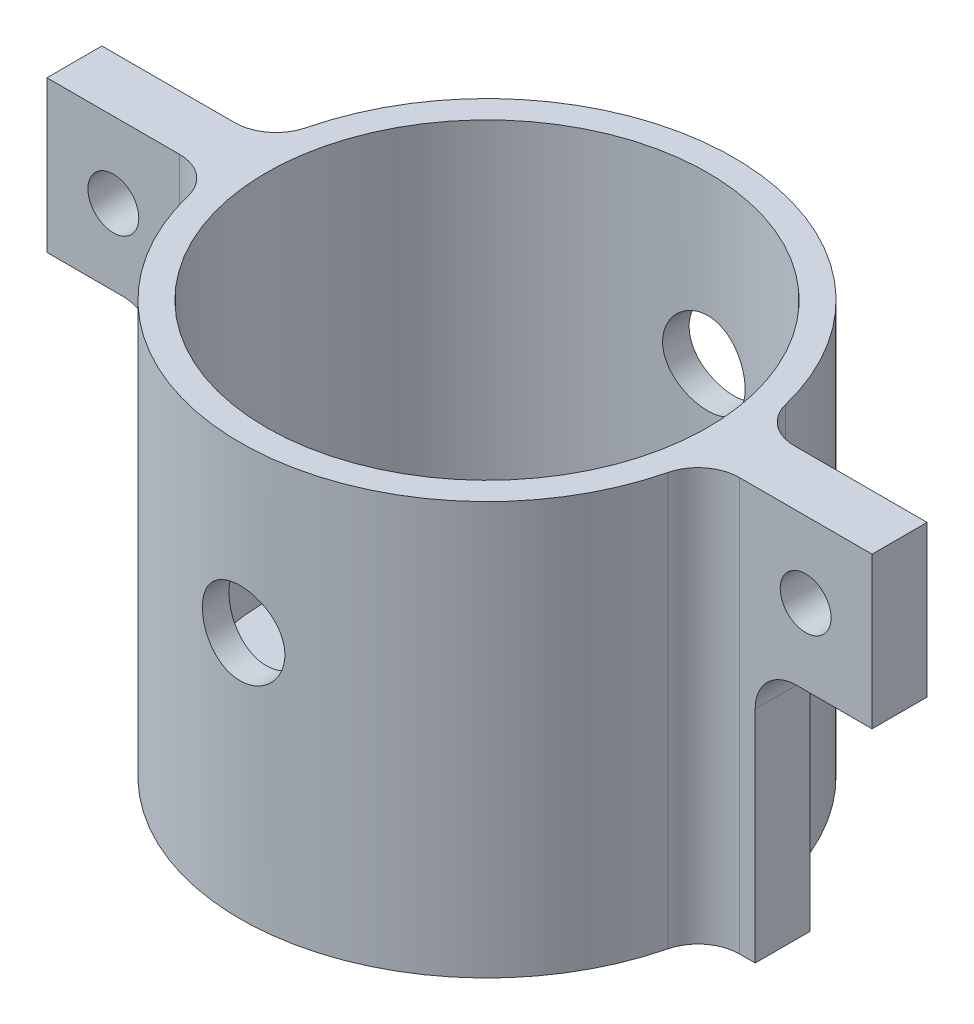
from build123d import *

# Parameters (mm, degrees)
BOSS_EXTRUDE1_DEPTH = 30
SKETCH4_W           = 4
SKETCH4_H           = 19
CUT_EXTRUDE3_DEPTH  = 8.5
SKETCH7_R           = 16.05
CUT_EXTRUDE4_DEPTH  = 27
SKETCH6_R           = 9
CUT_EXTRUDE5_DEPTH  = 4
FILLET3_R           = 3
FILLET4_R           = 3
SKETCH8_R           = 1.85
CUT_EXTRUDE6_DEPTH  = 4
SKETCH9_R           = 3
CUT_EXTRUDE7_DEPTH  = 37


with BuildPart() as part:
    # Sketch1 → Boss-Extrude1 (new body)
    with BuildSketch(Plane(origin=(0, 0, 0), x_dir=(1, 0, 0), z_dir=(0, 1, 0))):
        with BuildLine():
            Line((-30, -2), (-30, 2))
            Line((-30, 2), (-17.838231415, 2))
            ThreePointArc((-17.838231415, 2), (0, 17.95), (17.838231415, 2))
            Line((17.838231415, 2), (30, 2))
            Line((30, 2), (30, -2))
            Line((30, -2), (17.838231415, -2))
            ThreePointArc((17.838231415, -2), (0, -17.95), (-17.838231415, -2))
            Line((-17.838231415, -2), (-30, -2))
        make_face()
    extrude(amount=BOSS_EXTRUDE1_DEPTH)

    # Sketch4 → Cut-Extrude3 (cut)
    with BuildSketch(Plane.ZY.offset(30)):
        with Locations((0, 9.5)):
            Rectangle(SKETCH4_W, SKETCH4_H)
    cut_extrude3 = extrude(amount=-CUT_EXTRUDE3_DEPTH, mode=Mode.SUBTRACT)

    # Mirror1: Cut-Extrude3 across plane
    add(cut_extrude3.mirror(Plane(origin=(0, 0, 0), x_dir=(0, 0, 1), z_dir=(1, 0, 0))), mode=Mode.SUBTRACT)

    # Sketch7 → Cut-Extrude4 (cut)
    with BuildSketch(Plane(origin=(0, 30, 0), x_dir=(1, 0, 0), z_dir=(0, 1, 0))):
        with Locations(Location((0, 0, 0), (0, 0, 270))):
            Circle(SKETCH7_R)
    extrude(amount=-CUT_EXTRUDE4_DEPTH, mode=Mode.SUBTRACT)

    # Sketch6 → Cut-Extrude5 (cut)
    with BuildSketch(Plane.XZ):
        with Locations(Location((0, 0, 0), (0, 0, 270))):
            Circle(SKETCH6_R)
    extrude(amount=-CUT_EXTRUDE5_DEPTH, mode=Mode.SUBTRACT)

    # Fillet3
    fillet3_edges = [part.edges().sort_by_distance(p)[0] for p in [
        (-17.838231415, 15, 2),
        (-17.838231415, 15, -2),
        (17.838231415, 15, -2),
        (17.838231415, 15, 2),
    ]]
    fillet(fillet3_edges, radius=FILLET3_R)

    # Fillet4
    fillet4_edges = [part.edges().sort_by_distance(p)[0] for p in [
        (-21.5, 19, 0),
        (21.5, 19, 0),
    ]]
    fillet(fillet4_edges, radius=FILLET4_R)

    # Sketch8 → Cut-Extrude6 (cut)
    with BuildSketch(Plane(origin=(0, 0, -2), x_dir=(-1, 0, 0), z_dir=(0, 0, -1))):
        with Locations((-25.17, 24.5)):
            Circle(SKETCH8_R)
        with Locations(Location((25.17, 24.5, 0), (0, 0, 180))):
            Circle(SKETCH8_R)
    extrude(amount=-CUT_EXTRUDE6_DEPTH, mode=Mode.SUBTRACT)

    # Sketch9 → Cut-Extrude7 (cut)
    with BuildSketch(Plane(origin=(0, 0, -17.95), x_dir=(-1, 0, 0), z_dir=(0, 0, -1))):
        with Locations((0, 18)):
            Circle(SKETCH9_R)
    extrude(amount=-CUT_EXTRUDE7_DEPTH, mode=Mode.SUBTRACT)


solid = part.part
